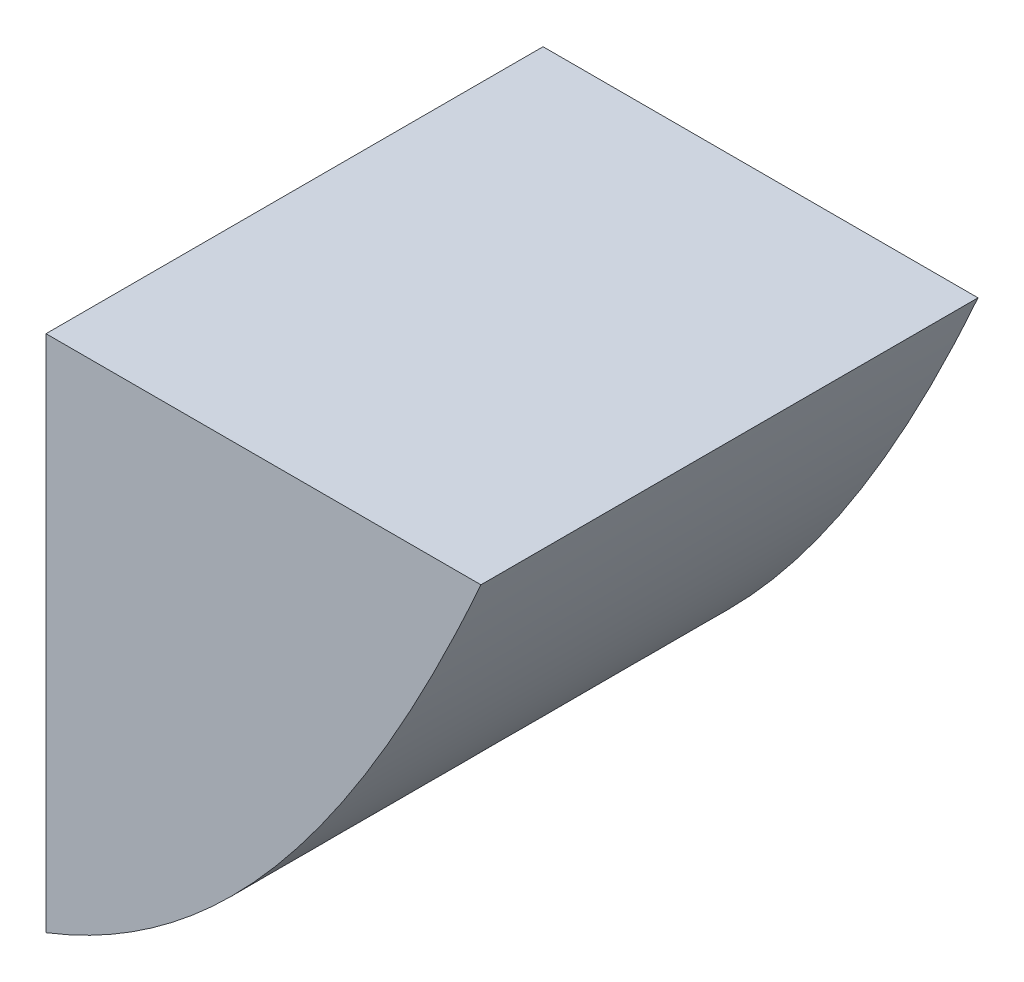
from build123d import *

# Parameters (mm, degrees)
FEATURE_PRISM_DEPTH = 8
PROFILE_CUT_W       = 7
PROFILE_CUT_H       = 13
FEATURE_TRIM_DEPTH  = 18.000000171


with BuildPart() as part:
    # profile:cubic → feature:prism (new body)
    with BuildSketch(Plane.XY):
        with BuildLine():
            Line((12, 9), (0, 9))
            Line((0, 9), (0, 0))
            add(Edge.make_bspline(
                [(0, 0), (4, 0), (8, 0), (12, 9)],
                knots=[0, 0, 0, 0, 1, 1, 1, 1], degree=3))
        make_face()
    extrude(amount=FEATURE_PRISM_DEPTH)

    # profile:cut → feature:trim (cut, through all)
    with BuildSketch(Plane.XY):
        with Locations((1.5, 4.5)):
            Rectangle(PROFILE_CUT_W, PROFILE_CUT_H)
    extrude(amount=FEATURE_TRIM_DEPTH, mode=Mode.SUBTRACT)


solid = part.part
